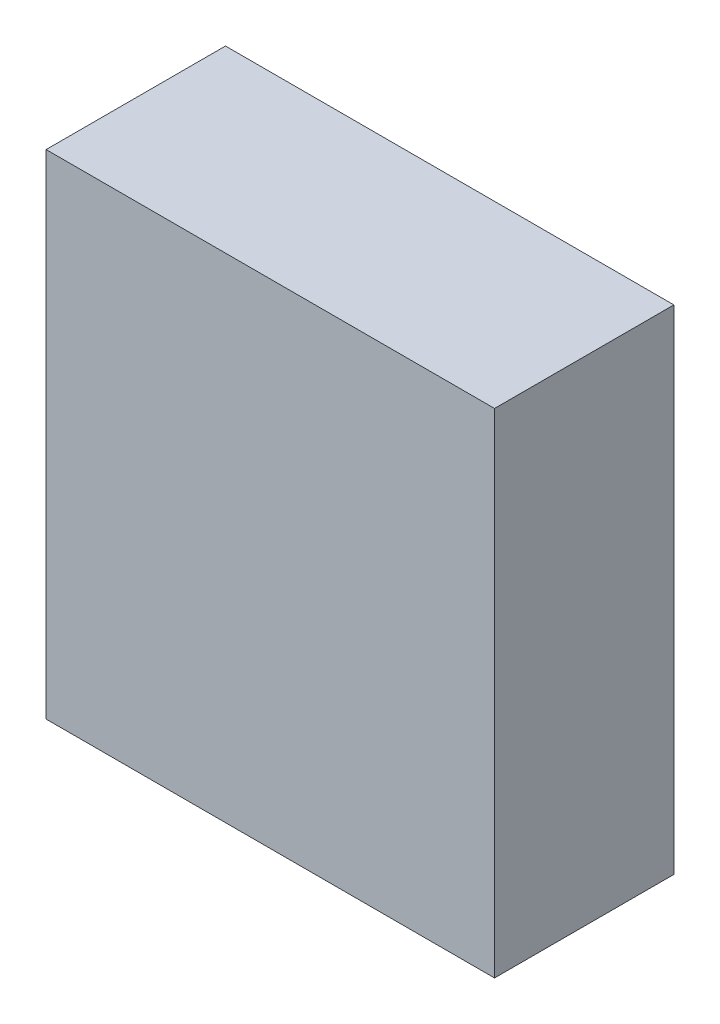
from build123d import *

# Parameters (mm, degrees)
TOPPING_ARKA_DUVAR_PANO_PLC_1_START = -736
SKETCH1_W                           = 100
SKETCH1_H                           = 110
TOPPING_ARKA_DUVAR_PANO_PLC_1_DEPTH = 40


with BuildPart() as part:
    # Sketch1 → TOPPING_arka_duvar_pano_plc_1 (new body)
    with BuildSketch(Plane.XY.offset(TOPPING_ARKA_DUVAR_PANO_PLC_1_START)):
        with Locations((170, 615)):
            Rectangle(SKETCH1_W, SKETCH1_H)
    extrude(amount=-TOPPING_ARKA_DUVAR_PANO_PLC_1_DEPTH)


solid = part.part
